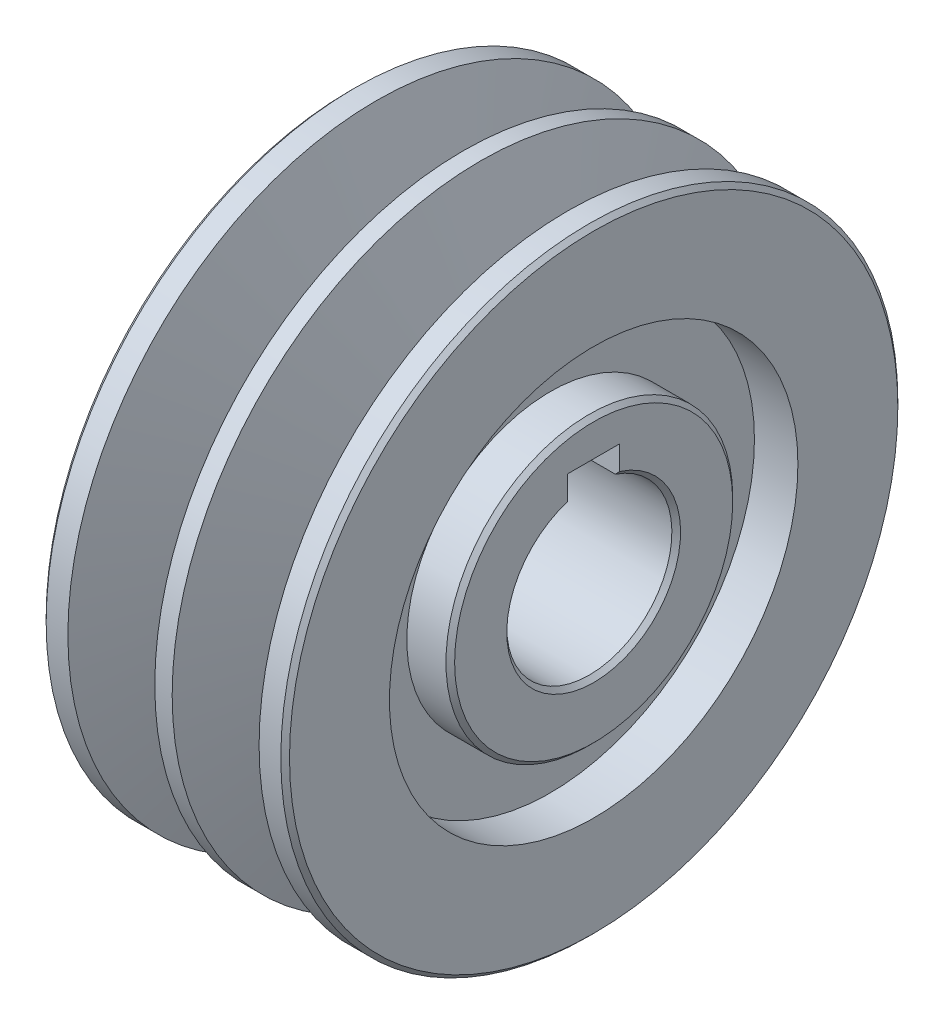
from build123d import *

# Parameters (mm, degrees)
CHAMFER1_SIZE      = 0.5
CHAMFER2_SIZE      = 0.5
FILLET2_R          = 1
CUT_EXTRUDE1_DEPTH = 58.484780595


with BuildPart() as part:
    # Sketch1 → Revolve1 (revolve)
    with BuildSketch(Plane(origin=(0, 0, 0), x_dir=(1, 0, 0), z_dir=(0, 1, 0))):
        Polygon((-14, 35.5), (-14, 23.5), (-9, 23.5), (-9, 16.5), (-14, 16.5), (-14, 9.5), (14, 9.5), (14, 16.5), (9, 16.5), (9, 23.5), (14, 23.5), (14, 35.5), (11, 35.5), (7.942693185, 25.5), (4.057306815, 25.5), (1, 35.5), (-1, 35.5), (-4.057306815, 25.5), (-7.942693185, 25.5), (-11, 35.5), align=None)
    revolve(axis=Axis((0, 0, 0), (-1, 0, 0)))

    # Chamfer1
    chamfer1_edges = [part.edges().sort_by_distance(p)[0] for p in [
        (14, 0, 9.5),
        (14, 0, 16.5),
        (14, 0, 35.5),
    ]]
    chamfer(chamfer1_edges, length=CHAMFER1_SIZE)

    # Chamfer2
    chamfer2_edges = [part.edges().sort_by_distance(p)[0] for p in [
        (-14, 0, 35.5),
        (-14, 0, 23.5),
        (-14, 0, 16.5),
        (-14, 0, 9.5),
    ]]
    chamfer(chamfer2_edges, length=CHAMFER2_SIZE)

    # Fillet2
    fillet2_edges = [part.edges().sort_by_distance(p)[0] for p in [
        (-9, 0, 23.5),
        (-9, 0, 16.5),
    ]]
    fillet(fillet2_edges, radius=FILLET2_R)

    # Sketch2 → Cut-Extrude1 (cut, through all)
    with BuildSketch(Plane(origin=(14, 0, 0), x_dir=(0, 0, -1), z_dir=(1, 0, 0))):
        Polygon((-3, 12.3), (-3, 7.432980878), (3, 7.432980878), (3, 9.5), (3, 12.3), align=None)
    extrude(amount=-CUT_EXTRUDE1_DEPTH, mode=Mode.SUBTRACT)


solid = part.part
